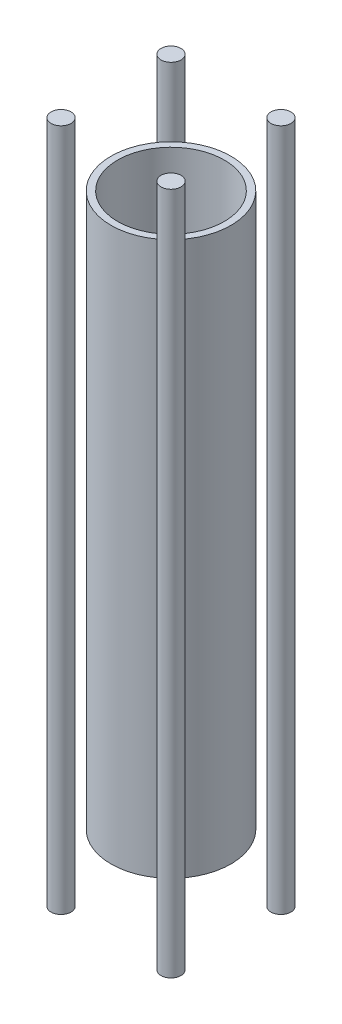
from build123d import *

# Parameters (mm, degrees)
SKETCH1_R                  = 18
SKETCH1_R_2                = 16
BOSS_EXTRUDE1_DEPTH        = 166
BOSS_EXTRUDE2_DEPTH        = 185
BOSS_EXTRUDE2_DEPTH_BACK   = 20
SKETCH2_R                  = 3
BOSS_EXTRUDE2_2_DEPTH      = 185
BOSS_EXTRUDE2_2_DEPTH_BACK = 20
BOSS_EXTRUDE2_3_DEPTH      = 185
BOSS_EXTRUDE2_3_DEPTH_BACK = 20
BOSS_EXTRUDE2_4_DEPTH      = 185
BOSS_EXTRUDE2_4_DEPTH_BACK = 20


with BuildPart() as part:
    # Sketch1 → Boss-Extrude1 (new body)
    with BuildSketch(Plane(origin=(0, 0, 0), x_dir=(1, 0, 0), z_dir=(0, 1, 0))):
        with Locations(Location((0, 0, 0), (0, 0, 270))):
            Circle(SKETCH1_R)
        with Locations(Location((0, 0, 0), (0, 0, 270))):
            Circle(SKETCH1_R_2, mode=Mode.SUBTRACT)
    extrude(amount=BOSS_EXTRUDE1_DEPTH)


with BuildPart() as body_2:
    # Sketch2 → Boss-Extrude2 (new, two sides: drawn at the far end of the back side and taken through both)
    with BuildSketch(Plane(origin=(0, 0, 0), x_dir=(1, 0, 0), z_dir=(0, 1, 0)).offset(-BOSS_EXTRUDE2_DEPTH_BACK)):
        with Locations(Location((-16.5, 16.5, 0), (0, 0, 270))):
            Circle(SKETCH2_R)
    extrude(amount=BOSS_EXTRUDE2_DEPTH + BOSS_EXTRUDE2_DEPTH_BACK)


with BuildPart() as body_3:
    # Sketch2 → Boss-Extrude2 2 (new, two sides: drawn at the far end of the back side and taken through both)
    with BuildSketch(Plane(origin=(0, 0, 0), x_dir=(1, 0, 0), z_dir=(0, 1, 0)).offset(-BOSS_EXTRUDE2_2_DEPTH_BACK)):
        with Locations(Location((16.5, 16.5, 0), (0, 0, 270))):
            Circle(SKETCH2_R)
    extrude(amount=BOSS_EXTRUDE2_2_DEPTH + BOSS_EXTRUDE2_2_DEPTH_BACK)


with BuildPart() as body_4:
    # Sketch2 → Boss-Extrude2 3 (new, two sides: drawn at the far end of the back side and taken through both)
    with BuildSketch(Plane(origin=(0, 0, 0), x_dir=(1, 0, 0), z_dir=(0, 1, 0)).offset(-BOSS_EXTRUDE2_3_DEPTH_BACK)):
        with Locations(Location((16.5, -16.5, 0), (0, 0, 270))):
            Circle(SKETCH2_R)
    extrude(amount=BOSS_EXTRUDE2_3_DEPTH + BOSS_EXTRUDE2_3_DEPTH_BACK)


with BuildPart() as body_5:
    # Sketch2 → Boss-Extrude2 4 (new, two sides: drawn at the far end of the back side and taken through both)
    with BuildSketch(Plane(origin=(0, 0, 0), x_dir=(1, 0, 0), z_dir=(0, 1, 0)).offset(-BOSS_EXTRUDE2_4_DEPTH_BACK)):
        with Locations(Location((-16.5, -16.5, 0), (0, 0, 270))):
            Circle(SKETCH2_R)
    extrude(amount=BOSS_EXTRUDE2_4_DEPTH + BOSS_EXTRUDE2_4_DEPTH_BACK)


solid = Compound([part.part, body_2.part, body_3.part, body_4.part, body_5.part])
